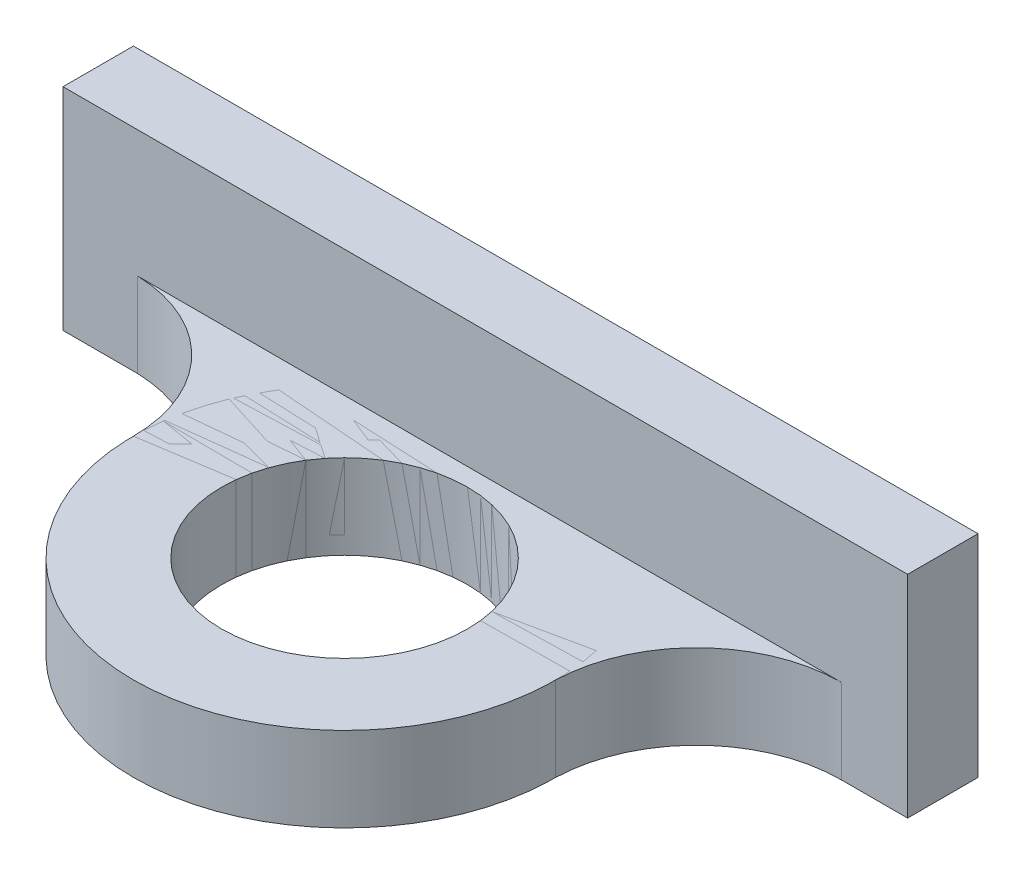
from build123d import *

# Parameters (mm, degrees)
SKETCH1_R           = 30
SKETCH1_R_2         = 17.4625
BOSS_EXTRUDE1_DEPTH = 12
BOSS_EXTRUDE2_DEPTH = 30
BOSS_EXTRUDE3_DEPTH = 12


with BuildPart() as part:
    # Sketch1 → Boss-Extrude1 (new body)
    with BuildSketch(Plane(origin=(0, 0, 0), x_dir=(1, 0, 0), z_dir=(0, 1, 0))):
        with Locations(Location((0, 0, 0), (0, 0, 270))):
            Circle(SKETCH1_R)
        with Locations(Location((0, 0, 0), (0, 0, 270))):
            Circle(SKETCH1_R_2, mode=Mode.SUBTRACT)
    extrude(amount=BOSS_EXTRUDE1_DEPTH)

    # Sketch5 → Boss-Extrude2 (add)
    with BuildSketch(Plane.XZ):
        Polygon((0, -30), (60, -30), (60, -20), (0, -20), (-60, -20), (-60, -30), align=None)
    extrude(amount=-BOSS_EXTRUDE2_DEPTH)


with BuildPart() as body_2:
    # Sketch6 → Boss-Extrude3 (new body)
    with BuildSketch(Plane.XZ):
        with BuildLine():
            ThreePointArc((-30, 0), (-28.025170769, -10.704662693), (-22.360679775, -20))
            Line((-22.360679775, -20), (22.360679775, -20))
            ThreePointArc((22.360679775, -20), (28.025170769, -10.704662693), (30, 0))
            Line((30, 0), (17.4625, 0))
            ThreePointArc((17.4625, 0), (0, -17.4625), (-17.4625, 0))
            Line((-17.4625, 0), (-30, 0))
        make_face()
        with BuildLine():
            ThreePointArc((30, 0), (28.025170769, -10.704662693), (22.360679775, -20))
            Line((22.360679775, -20), (50.590169944, -20))
            ThreePointArc((50.590169944, -20), (36.237860911, -14.176946646), (30, 0))
        make_face()
        with BuildLine():
            Line((-49.426745923, -20), (-22.360679775, -20))
            ThreePointArc((-22.360679775, -20), (-28.025170769, -10.704662693), (-30, 0))
            ThreePointArc((-30, 0), (-35.6561489, -13.940933049), (-49.426745923, -20))
        make_face()
    extrude(amount=-BOSS_EXTRUDE3_DEPTH)


solid = Compound([part.part, body_2.part])
